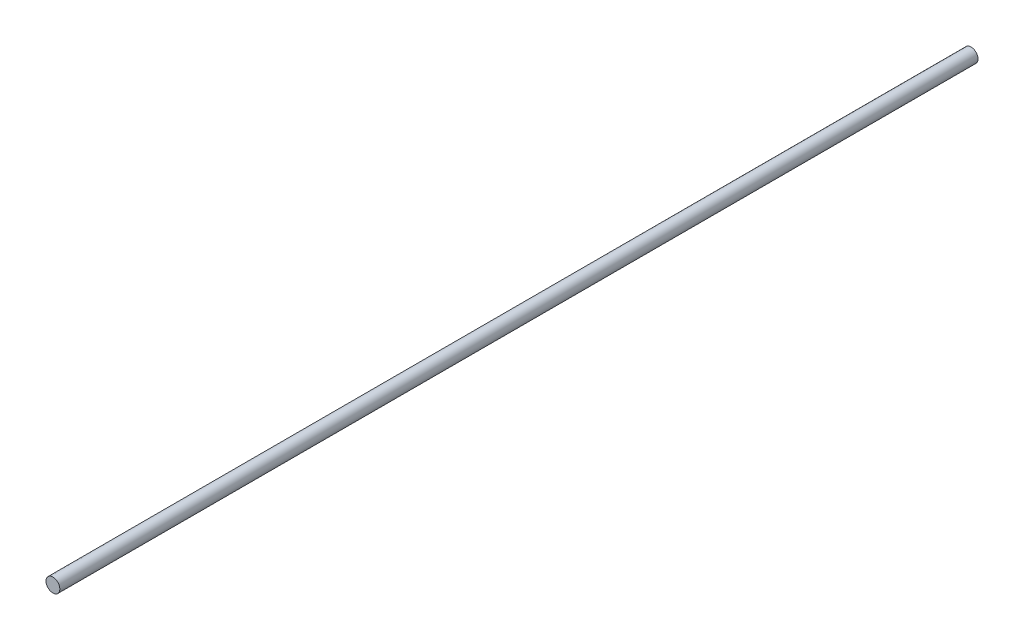
from build123d import *

# Parameters (mm, degrees)
SKETCH1_R                    = 6.35
BOSS_EXTRUDE1_DEPTH          = 914.4
ENL_V_START                  = -34.29
ESQUISSE1_R                  = 6.35
ENL_V_MAT_EXTRU_1_DEPTH      = 34.29
ENL_V_MAT_EXTRU_3_DEPTH      = 881.155814103
ENL_V_MAT_EXTRU_3_DEPTH_BACK = 881.155814103
ESQUISSE3_W                  = 12.7
ESQUISSE3_H                  = 38.1


with BuildPart() as part:
    # Sketch1 → Boss-Extrude1 (new body)
    with BuildSketch(Plane.XY):
        Circle(SKETCH1_R)
    extrude(amount=BOSS_EXTRUDE1_DEPTH)

    # Esquisse1 → Enlèv. mat.-Extru.1 (cut)
    with BuildSketch(Plane.XY.offset(914.4).offset(ENL_V_START)):
        Circle(ESQUISSE1_R)
    extrude(amount=ENL_V_MAT_EXTRU_1_DEPTH, mode=Mode.SUBTRACT)

    # Esquisse3 → Enlèv. mat.-Extru.3 (cut, two sides: drawn at the far end of the back side and taken through both)
    with BuildSketch(Plane(origin=(0, 0, 0), x_dir=(1, 0, 0), z_dir=(0, 1, 0)).offset(-ENL_V_MAT_EXTRU_3_DEPTH_BACK)):
        with Locations((0, -19.05)):
            Rectangle(ESQUISSE3_W, ESQUISSE3_H)
    extrude(amount=ENL_V_MAT_EXTRU_3_DEPTH + ENL_V_MAT_EXTRU_3_DEPTH_BACK, mode=Mode.SUBTRACT)


solid = part.part
